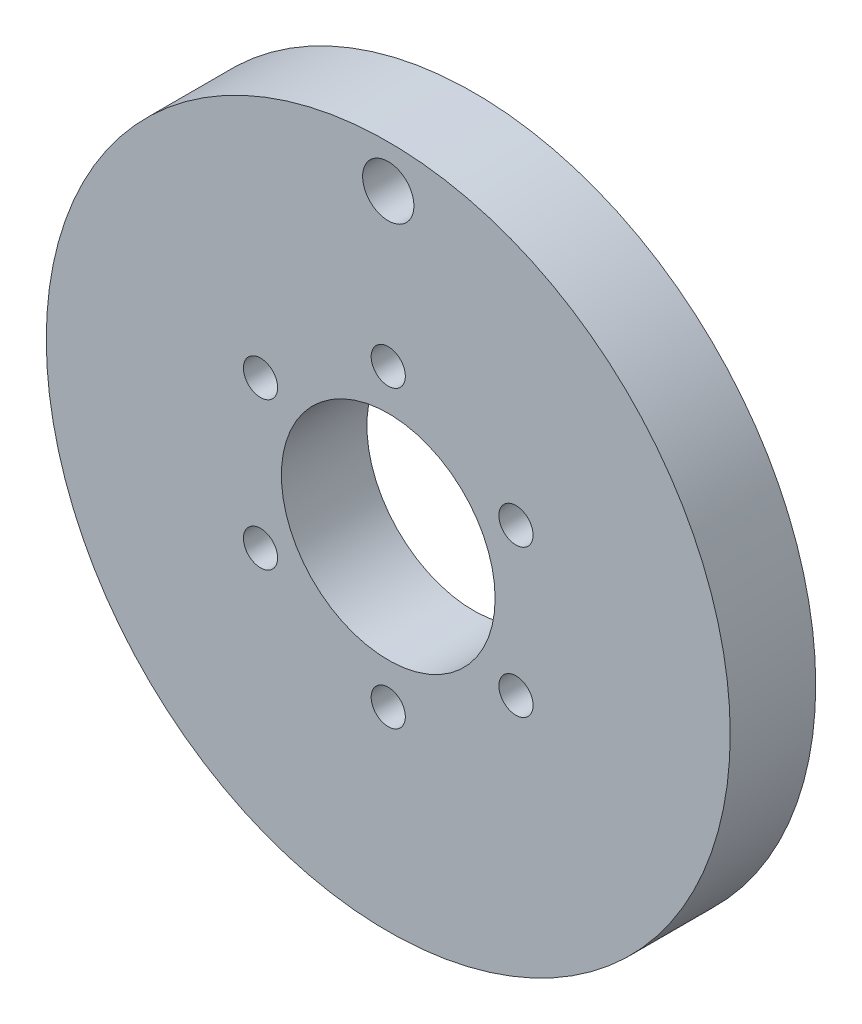
from build123d import *

# Parameters (mm, degrees)
SKETCH_1_R      = 40
SKETCH_1_R_2    = 12.5
SKETCH_1_R_3    = 2
SKETCH_1_R_4    = 3
EXTRUDE_1_DEPTH = 10


with BuildPart() as part:
    # 草图1 → 凸台-拉伸1 (new body)
    with BuildSketch(Plane.XY):
        with Locations((-35.478977731, 11.880589307)):
            Circle(SKETCH_1_R)
        with Locations((-35.478977731, 11.880589307)):
            Circle(SKETCH_1_R_2, mode=Mode.SUBTRACT)
        with Locations((-35.478977731, 29.130589307)):
            Circle(SKETCH_1_R_3, mode=Mode.SUBTRACT)
        with Locations((-20.540039516, 20.505589307)):
            Circle(SKETCH_1_R_3, mode=Mode.SUBTRACT)
        with Locations((-20.540039516, 3.255589307)):
            Circle(SKETCH_1_R_3, mode=Mode.SUBTRACT)
        with Locations((-35.478977731, -5.369410693)):
            Circle(SKETCH_1_R_3, mode=Mode.SUBTRACT)
        with Locations((-50.417915947, 3.255589307)):
            Circle(SKETCH_1_R_3, mode=Mode.SUBTRACT)
        with Locations((-50.417915947, 20.505589307)):
            Circle(SKETCH_1_R_3, mode=Mode.SUBTRACT)
        with Locations((-35.478977731, 46.880589307)):
            Circle(SKETCH_1_R_4, mode=Mode.SUBTRACT)
    extrude(amount=EXTRUDE_1_DEPTH)


solid = part.part
